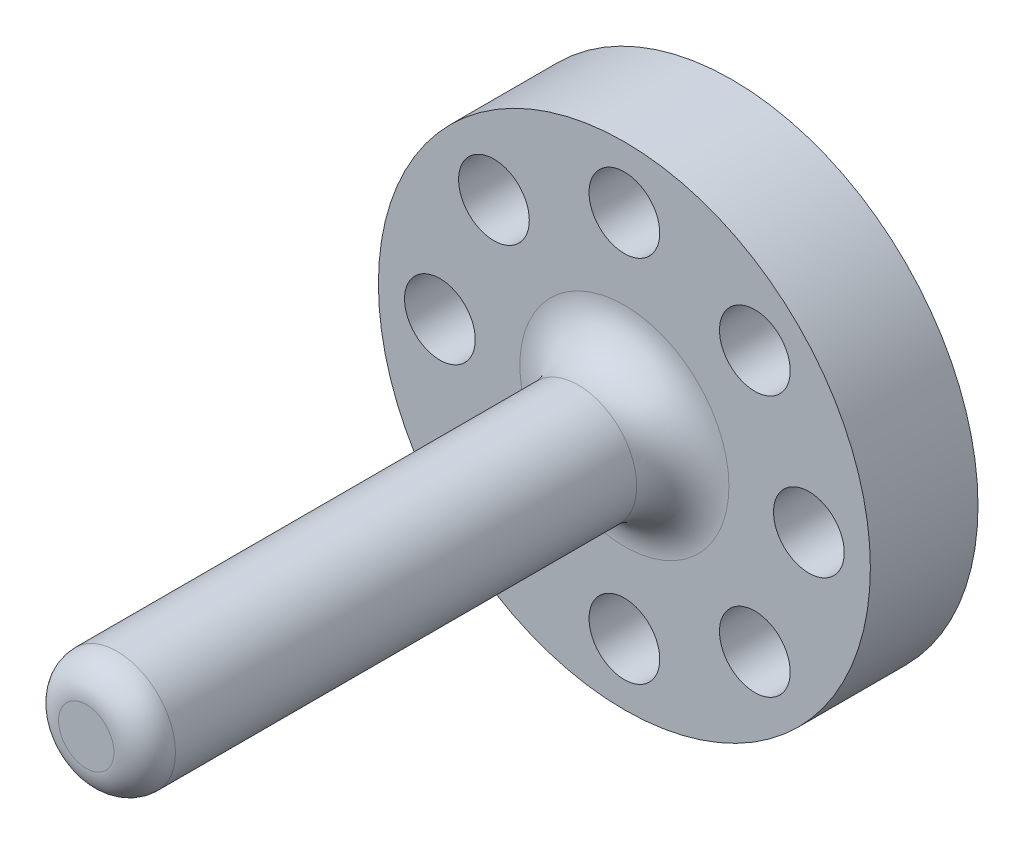
from build123d import *

# Parameters (mm, degrees)
SKETCH_1_R      = 8
SKETCH_1_R_2    = 1.15
SKETCH_1_R_3    = 4
EXTRUDE_1_DEPTH = 2
SKETCH_2_R      = 8
SKETCH_2_R_2    = 1.15
EXTRUDE_2_DEPTH = 1.5
SKETCH_3_R      = 1.9
EXTRUDE_3_DEPTH = 17.5
FILLET_1_R      = 1
FILLET_2_R      = 1.5


with BuildPart() as part:
    # ｽｹｯﾁ1 → ﾎﾞｽ - 押し出し1 (new body)
    with BuildSketch(Plane.XY):
        Circle(SKETCH_1_R)
        with Locations((0, 6)):
            Circle(SKETCH_1_R_2, mode=Mode.SUBTRACT)
        with Locations((4.242640687, 4.242640687)):
            Circle(SKETCH_1_R_2, mode=Mode.SUBTRACT)
        with Locations((6, 0)):
            Circle(SKETCH_1_R_2, mode=Mode.SUBTRACT)
        with Locations((4.242640687, -4.242640687)):
            Circle(SKETCH_1_R_2, mode=Mode.SUBTRACT)
        with Locations((0, -6)):
            Circle(SKETCH_1_R_2, mode=Mode.SUBTRACT)
        with Locations((-4.242640687, -4.242640687)):
            Circle(SKETCH_1_R_2, mode=Mode.SUBTRACT)
        with Locations((-6, 0)):
            Circle(SKETCH_1_R_2, mode=Mode.SUBTRACT)
        with Locations((-4.242640687, 4.242640687)):
            Circle(SKETCH_1_R_2, mode=Mode.SUBTRACT)
        Circle(SKETCH_1_R_3, mode=Mode.SUBTRACT)
    extrude(amount=EXTRUDE_1_DEPTH)

    # ｽｹｯﾁ2 → ﾎﾞｽ - 押し出し2 (add)
    with BuildSketch(Plane.XY.offset(2)):
        Circle(SKETCH_2_R)
        with Locations((0, 6)):
            Circle(SKETCH_2_R_2, mode=Mode.SUBTRACT)
        with Locations((4.242640687, 4.242640687)):
            Circle(SKETCH_2_R_2, mode=Mode.SUBTRACT)
        with Locations((6, 0)):
            Circle(SKETCH_2_R_2, mode=Mode.SUBTRACT)
        with Locations((4.242640687, -4.242640687)):
            Circle(SKETCH_2_R_2, mode=Mode.SUBTRACT)
        with Locations((0, -6)):
            Circle(SKETCH_2_R_2, mode=Mode.SUBTRACT)
        with Locations((-4.242640687, -4.242640687)):
            Circle(SKETCH_2_R_2, mode=Mode.SUBTRACT)
        with Locations((-6, 0)):
            Circle(SKETCH_2_R_2, mode=Mode.SUBTRACT)
        with Locations((-4.242640687, 4.242640687)):
            Circle(SKETCH_2_R_2, mode=Mode.SUBTRACT)
    extrude(amount=EXTRUDE_2_DEPTH)

    # ｽｹｯﾁ3 → ﾎﾞｽ - 押し出し3 (add)
    with BuildSketch(Plane.XY.offset(3.5)):
        Circle(SKETCH_3_R)
    extrude(amount=EXTRUDE_3_DEPTH)

    # ﾌｨﾚｯﾄ1
    fillet_1_edges = [part.edges().sort_by_distance(p)[0] for p in [
        (-1.9, 0, 21),
    ]]
    fillet(fillet_1_edges, radius=FILLET_1_R)

    # ﾌｨﾚｯﾄ2
    fillet_2_edges = [part.edges().sort_by_distance(p)[0] for p in [
        (-1.9, 0, 3.5),
    ]]
    fillet(fillet_2_edges, radius=FILLET_2_R)


solid = part.part
